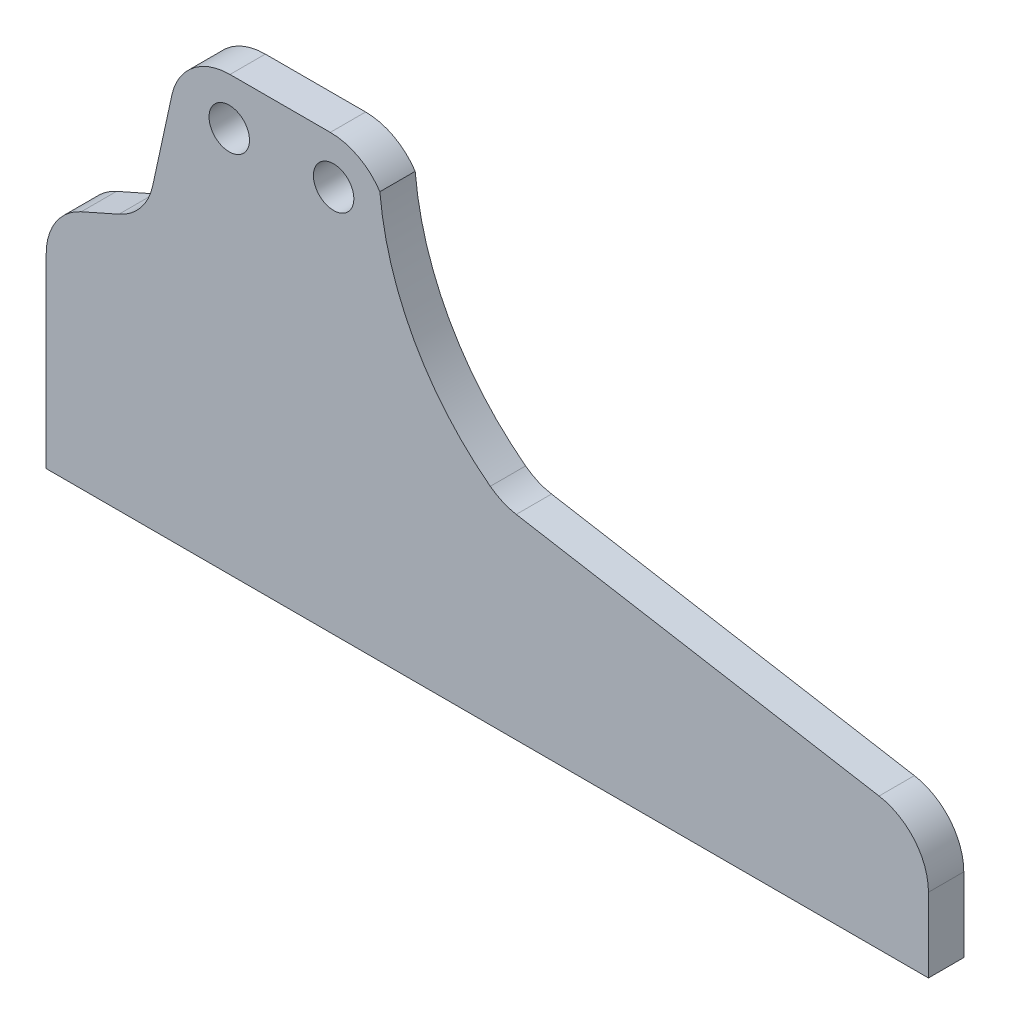
from build123d import *

# Parameters (mm, degrees)
CROQUIS2_R              = 3.435535485
SALIENTE_EXTRUIR1_DEPTH = 6


with BuildPart() as part:
    # Croquis2 → Saliente-Extruir1 (new body)
    with BuildSketch(Plane.XY):
        with BuildLine():
            Line((75.476244536, -42.362655144), (-74.410975533, -42.362655144))
            Line((-74.410975533, -42.362655144), (-74.410975533, -10.730962139))
            ThreePointArc((-74.410975533, -10.730962139), (-72.792282586, -5.276267639), (-68.460237116, -1.587468243))
            Line((-68.460237116, -1.587468243), (-62.049591399, 1.251532003))
            ThreePointArc((-62.049591399, 1.251532003), (-58.348209926, 4.076202257), (-56.327089342, 8.270729457))
            Line((-56.327089342, 8.270729457), (-53.063252273, 23.284379976))
            ThreePointArc((-53.063252273, 23.284379976), (-49.529087977, 29.006996787), (-43.186320825, 31.244845149))
            Line((-43.186320825, 31.244845149), (-26.148431061, 31.244845149))
            ThreePointArc((-26.148431061, 31.244845149), (-21.368566285, 30.043227891), (-17.725183812, 26.724078081))
            ThreePointArc((-17.725183812, 26.724078081), (-11.921972825, 7.766213541), (1.029468531, -7.245050647))
            ThreePointArc((1.029468531, -7.245050647), (3.120257187, -8.473650696), (5.443510228, -9.168884899))
            Line((5.443510228, -9.168884899), (67.083811667, -19.782734484))
            ThreePointArc((67.083811667, -19.782734484), (73.098451393, -23.231181656), (75.476244536, -29.743767833))
            Line((75.476244536, -29.743767833), (75.476244536, -42.362655144))
        make_face()
        with Locations((-25.582237715, 23.471115745)):
            Circle(CROQUIS2_R, mode=Mode.SUBTRACT)
        with Locations((-43.316057918, 23.228186701)):
            Circle(CROQUIS2_R, mode=Mode.SUBTRACT)
    extrude(amount=SALIENTE_EXTRUIR1_DEPTH)


solid = part.part
